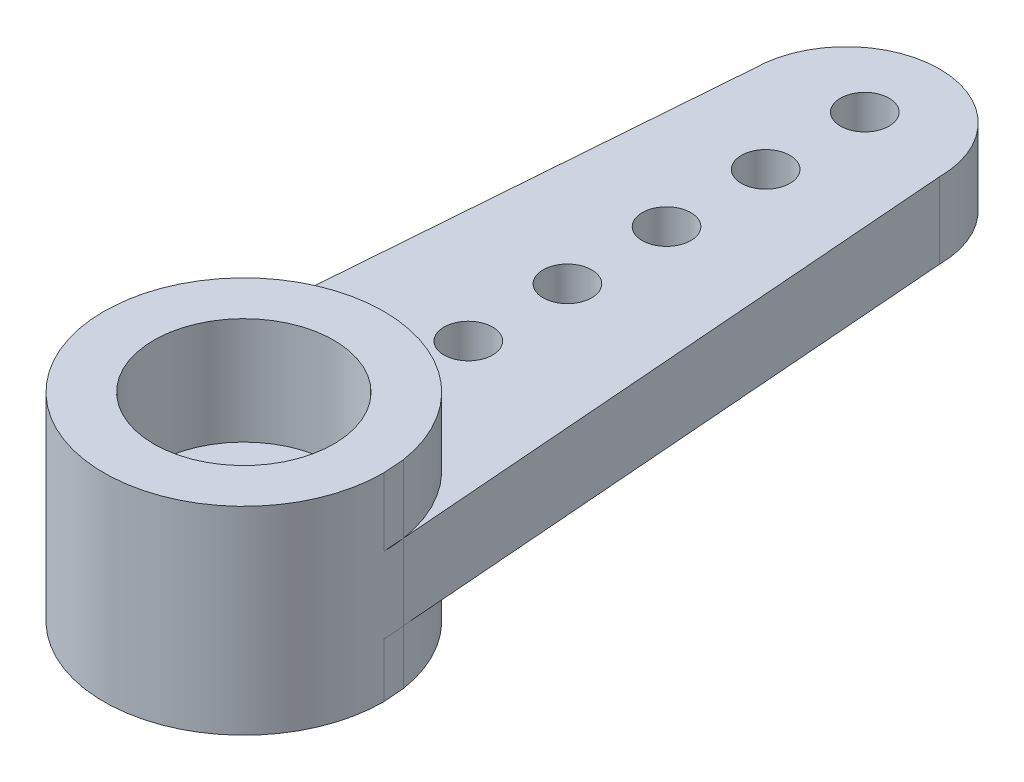
from build123d import *

# Parameters (mm, degrees)
SKETCH1_R           = 0.625
SKETCH1_R_2         = 1.265
BOSS_EXTRUDE2_DEPTH = 1.95
BOSS_EXTRUDE3_START = -1.4
SKETCH1_4_R         = 2.315
BOSS_EXTRUDE3_DEPTH = 1.4
SKETCH1_5_R         = 2.315
BOSS_EXTRUDE4_DEPTH = 3.7
CUT_EXTRUDE1_START  = -1
SKETCH4_R           = 2.315
SKETCH4_R_2         = 1.265
CUT_EXTRUDE1_DEPTH  = 1


with BuildPart() as part:
    # Sketch1 → Boss-Extrude2 (new body)
    with BuildSketch(Plane(origin=(0, 0, 0), x_dir=(1, 0, 0), z_dir=(0, 1, 0))):
        with BuildLine():
            Line((3.557102073, 0.554098225), (2.4, 15.5))
            ThreePointArc((2.4, 15.5), (0, 17.9), (-2.4, 15.5))
            Line((-2.4, 15.5), (-3.557102073, 0.554098225))
            ThreePointArc((-3.557102073, 0.554098225), (0, -3.6), (3.557102073, 0.554098225))
        make_face()
        with Locations((0, 13.425)):
            Circle(SKETCH1_R, mode=Mode.SUBTRACT)
        with Locations((0, 10.875)):
            Circle(SKETCH1_R, mode=Mode.SUBTRACT)
        with Locations((0, 8.325)):
            Circle(SKETCH1_R, mode=Mode.SUBTRACT)
        with Locations((0, 5.775)):
            Circle(SKETCH1_R, mode=Mode.SUBTRACT)
        Circle(SKETCH1_R_2, mode=Mode.SUBTRACT)
        with Locations((0, 15.975)):
            Circle(SKETCH1_R, mode=Mode.SUBTRACT)
    extrude(amount=BOSS_EXTRUDE2_DEPTH)

    # Sketch1<4> → Boss-Extrude3 (add)
    with BuildSketch(Plane(origin=(0, 0, 0), x_dir=(1, 0, 0), z_dir=(0, 1, 0)).offset(BOSS_EXTRUDE3_START)):
        with BuildLine():
            ThreePointArc((-3.6, 0), (0, -3.6), (3.6, 0))
            Line((3.6, 0), (3.557102073, 0.554098225))
            ThreePointArc((3.557102073, 0.554098225), (0, 3.6), (-3.557102073, 0.554098225))
            Line((-3.557102073, 0.554098225), (-3.6, 0))
        make_face()
        Circle(SKETCH1_4_R, mode=Mode.SUBTRACT)
    extrude(amount=BOSS_EXTRUDE3_DEPTH)

    # Sketch1<5> → Boss-Extrude4 (add)
    with BuildSketch(Plane(origin=(0, 0, 0), x_dir=(1, 0, 0), z_dir=(0, 1, 0))):
        with BuildLine():
            ThreePointArc((-3.6, 0), (0, -3.6), (3.6, 0))
            Line((3.6, 0), (3.557102073, 0.554098225))
            ThreePointArc((3.557102073, 0.554098225), (0, 3.6), (-3.557102073, 0.554098225))
            Line((-3.557102073, 0.554098225), (-3.6, 0))
        make_face()
        Circle(SKETCH1_5_R, mode=Mode.SUBTRACT)
    extrude(amount=BOSS_EXTRUDE4_DEPTH)

    # Sketch4 → Cut-Extrude1 (cut)
    with BuildSketch(Plane(origin=(0, 1.95, 0), x_dir=(1, 0, 0), z_dir=(0, 1, 0)).offset(CUT_EXTRUDE1_START)):
        Circle(SKETCH4_R)
        Circle(SKETCH4_R_2, mode=Mode.SUBTRACT)
    extrude(amount=CUT_EXTRUDE1_DEPTH, mode=Mode.SUBTRACT)


solid = part.part
